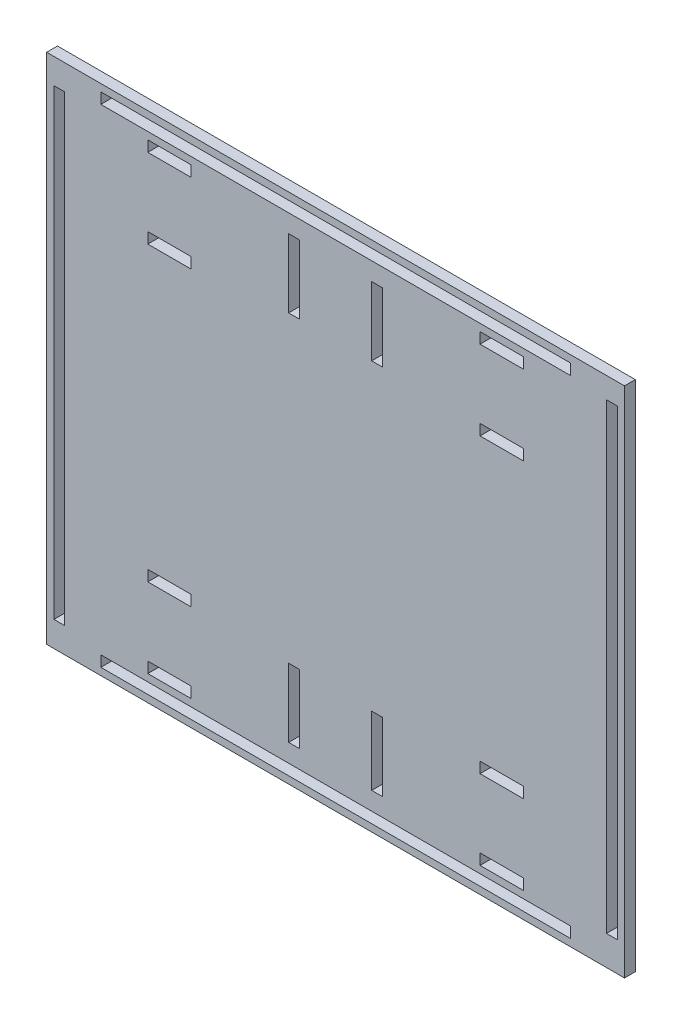
from build123d import *

# Parameters (mm, degrees)
SKETCH1_W           = 160
SKETCH1_H           = 142
SKETCH1_W_2         = 130
SKETCH1_H_2         = 3
SKETCH1_W_3         = 3
SKETCH1_H_3         = 128
SKETCH1_W_4         = 12
SKETCH1_H_4         = 19
BOSS_EXTRUDE1_DEPTH = 3


with BuildPart() as part:
    # Sketch1 → Boss-Extrude1 (new body)
    with BuildSketch(Plane.XY):
        with Locations((-2.653971439, -21.497313052)):
            Rectangle(SKETCH1_W, SKETCH1_H)
        with Locations((-2.653971439, -88.997313052)):
            Rectangle(SKETCH1_W_2, SKETCH1_H_2, mode=Mode.SUBTRACT)
        with Locations((-2.653971439, 46.002686948)):
            Rectangle(SKETCH1_W_2, SKETCH1_H_2, mode=Mode.SUBTRACT)
        with Locations((-79.153971439, -21.497313052)):
            Rectangle(SKETCH1_W_3, SKETCH1_H_3, mode=Mode.SUBTRACT)
        with Locations((73.846028561, -20.307455235)):
            Rectangle(SKETCH1_W_3, SKETCH1_H_3, mode=Mode.SUBTRACT)
        with Locations((43.346028561, -61.997313052)):
            Rectangle(SKETCH1_W_4, SKETCH1_H_2, mode=Mode.SUBTRACT)
        with Locations((43.346028561, -83.997313052)):
            Rectangle(SKETCH1_W_4, SKETCH1_H_2, mode=Mode.SUBTRACT)
        with Locations((43.346028561, 41.002686948)):
            Rectangle(SKETCH1_W_4, SKETCH1_H_2, mode=Mode.SUBTRACT)
        with Locations((8.846028561, -72.997313052)):
            Rectangle(SKETCH1_W_3, SKETCH1_H_4, mode=Mode.SUBTRACT)
        with Locations((43.346028561, 19.002686948)):
            Rectangle(SKETCH1_W_4, SKETCH1_H_2, mode=Mode.SUBTRACT)
        with Locations((8.846028561, 30.002686948)):
            Rectangle(SKETCH1_W_3, SKETCH1_H_4, mode=Mode.SUBTRACT)
        with Locations((-14.153971439, -72.997313052)):
            Rectangle(SKETCH1_W_3, SKETCH1_H_4, mode=Mode.SUBTRACT)
        with Locations((-48.653971439, -83.997313052)):
            Rectangle(SKETCH1_W_4, SKETCH1_H_2, mode=Mode.SUBTRACT)
        with Locations((-48.653971439, -61.997313052)):
            Rectangle(SKETCH1_W_4, SKETCH1_H_2, mode=Mode.SUBTRACT)
        with Locations((-48.653971439, 19.002686948)):
            Rectangle(SKETCH1_W_4, SKETCH1_H_2, mode=Mode.SUBTRACT)
        with Locations((-48.653971439, 41.002686948)):
            Rectangle(SKETCH1_W_4, SKETCH1_H_2, mode=Mode.SUBTRACT)
        with Locations((-14.153971439, 30.002686948)):
            Rectangle(SKETCH1_W_3, SKETCH1_H_4, mode=Mode.SUBTRACT)
    extrude(amount=BOSS_EXTRUDE1_DEPTH)


solid = part.part
